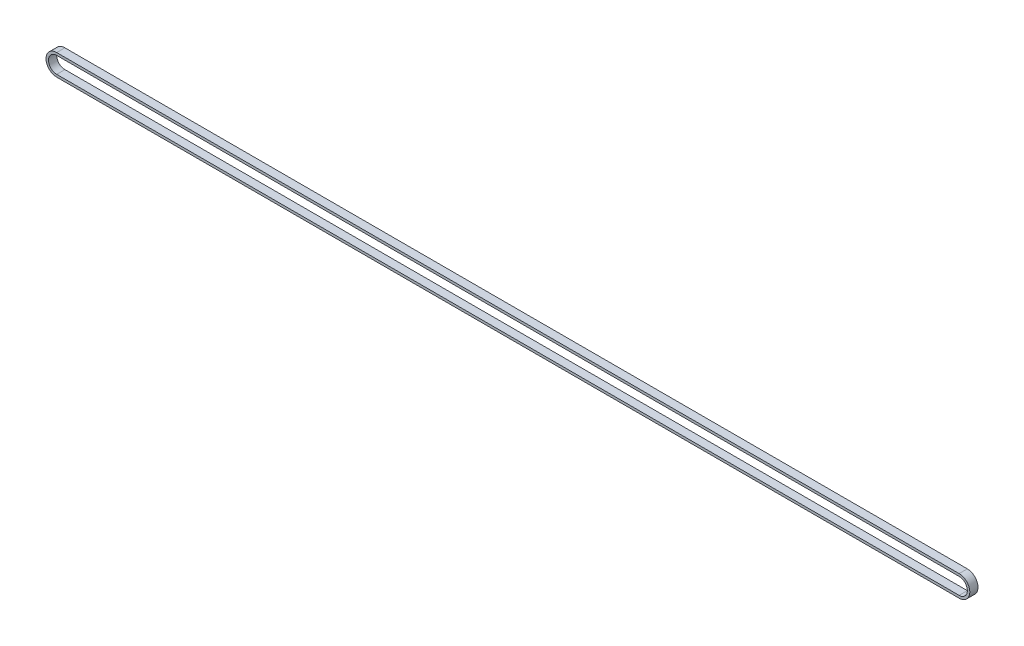
from build123d import *

# Parameters (mm, degrees)
BOSS_EXTRUDE1_DEPTH = 10


with BuildPart() as part:
    # Sketch1 → Boss-Extrude1 (new body)
    with BuildSketch(Plane.XY):
        with BuildLine():
            Line((-550, 13), (550, 13))
            ThreePointArc((550, 13), (563, 2.39e-07), (550.000000478, -13))
            Line((550.000000478, -13), (-550.000000368, -13))
            ThreePointArc((-550.000000368, -13), (-563, 1.84e-07), (-550, 13))
        make_face()
        with BuildLine():
            Line((-550.000000368, -10), (550.000000368, -10))
            ThreePointArc((550.000000368, -10), (560, 1.84e-07), (550, 10))
            Line((550, 10), (-550, 10))
            ThreePointArc((-550, 10), (-560, 1.84e-07), (-550.000000368, -10))
        make_face(mode=Mode.SUBTRACT)
    extrude(amount=BOSS_EXTRUDE1_DEPTH)


solid = part.part
